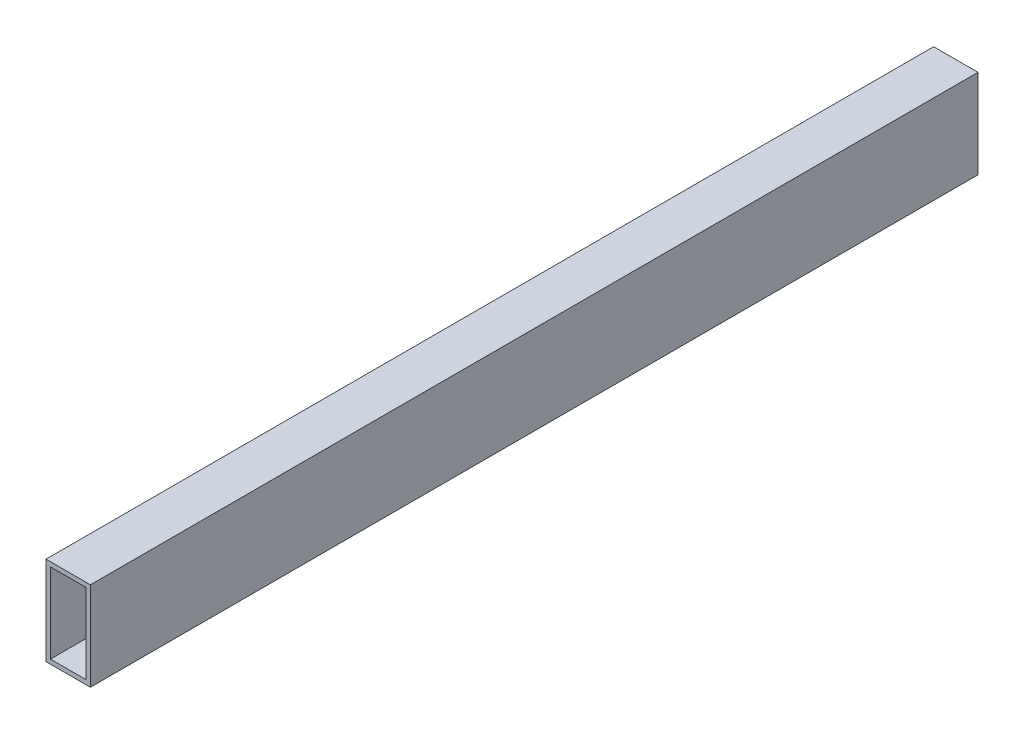
from build123d import *

# Parameters (mm, degrees)
SKETCH1_W           = 25
SKETCH1_H           = 50
SKETCH1_W_2         = 20
SKETCH1_H_2         = 45
BOSS_EXTRUDE1_DEPTH = 500


with BuildPart() as part:
    # Sketch1 → Boss-Extrude1 (new body)
    with BuildSketch(Plane.XY):
        Rectangle(SKETCH1_W, SKETCH1_H)
        Rectangle(SKETCH1_W_2, SKETCH1_H_2, mode=Mode.SUBTRACT)
    extrude(amount=BOSS_EXTRUDE1_DEPTH)


solid = part.part
